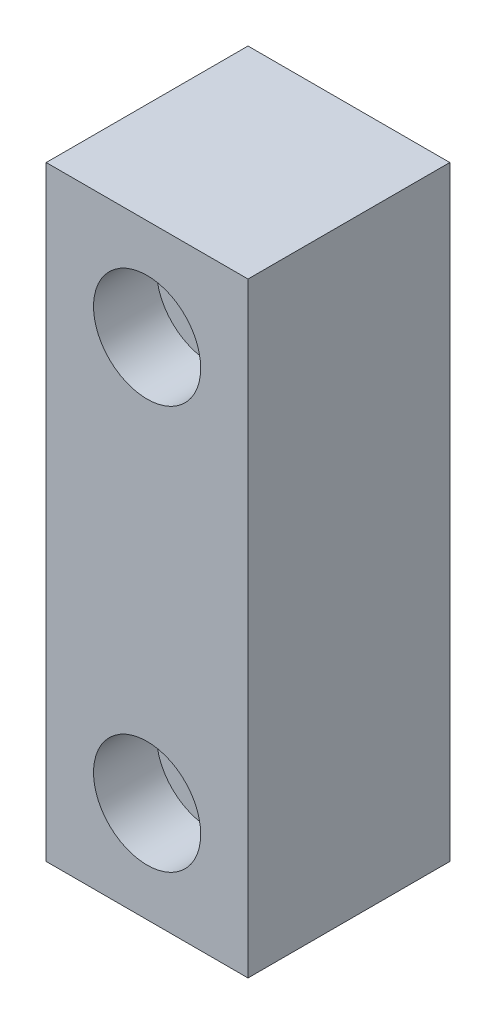
from build123d import *

# Parameters (mm, degrees)
SKETCH1_W                                         = 76.2
SKETCH1_H                                         = 25.4
BOSS_EXTRUDE1_DEPTH                               = 12.7
CBORE_FOR_5_16_SOCKET_HEAD_CAP_SCREW1_D           = 8.7376
CBORE_FOR_5_16_SOCKET_HEAD_CAP_SCREW1_DEPTH       = 25.4
CBORE_FOR_5_16_SOCKET_HEAD_CAP_SCREW1_CBORE_D     = 13.4874
CBORE_FOR_5_16_SOCKET_HEAD_CAP_SCREW1_CBORE_DEPTH = 7.9248
CBORE_FOR_5_16_SOCKET_HEAD_CAP_SCREW1_TIP         = 2.625039872


with BuildPart() as part:
    # Sketch1 → Boss-Extrude1 (new, symmetric)
    with BuildSketch(Plane(origin=(0, 0, 0), x_dir=(0, 1, 0), z_dir=(0, 0, 1))):
        Rectangle(SKETCH1_W, SKETCH1_H)
    extrude(amount=BOSS_EXTRUDE1_DEPTH, both=True)

    # CBORE for 5/16 Socket Head Cap Screw1
    with Locations(Plane.XY.offset(12.7)):
        with Locations((0, -25.4), (0, 25.4)):
            CounterBoreHole(CBORE_FOR_5_16_SOCKET_HEAD_CAP_SCREW1_D / 2, CBORE_FOR_5_16_SOCKET_HEAD_CAP_SCREW1_CBORE_D / 2, CBORE_FOR_5_16_SOCKET_HEAD_CAP_SCREW1_CBORE_DEPTH, depth=CBORE_FOR_5_16_SOCKET_HEAD_CAP_SCREW1_DEPTH)
            with Locations((0, 0, -(CBORE_FOR_5_16_SOCKET_HEAD_CAP_SCREW1_DEPTH + CBORE_FOR_5_16_SOCKET_HEAD_CAP_SCREW1_TIP / 2))):  # 118° drill point
                Cone(0, CBORE_FOR_5_16_SOCKET_HEAD_CAP_SCREW1_D / 2, CBORE_FOR_5_16_SOCKET_HEAD_CAP_SCREW1_TIP, mode=Mode.SUBTRACT)


solid = part.part
